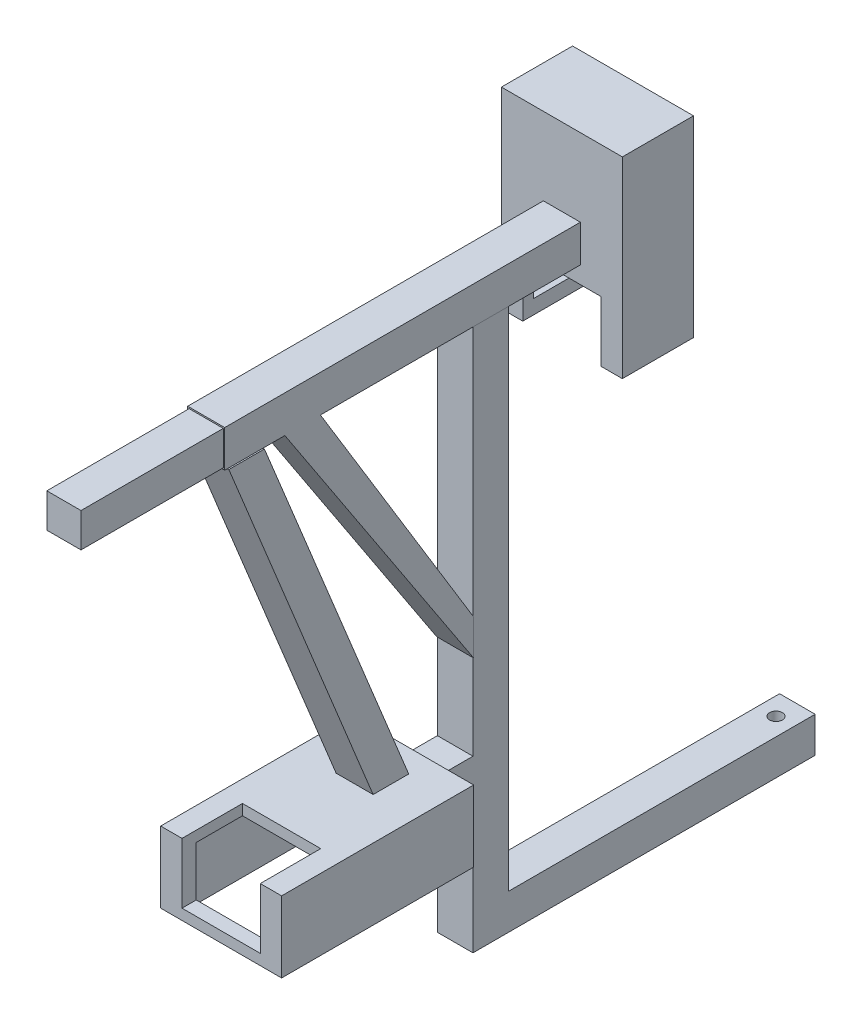
from build123d import *

# Parameters (mm, degrees)
SKETCH1_W            = 4.8
SKETCH1_H            = 4.8
BOSS_EXTRUDE1_DEPTH  = 20
SKETCH2_W            = 5.2
SKETCH2_H            = 5.2
BOSS_EXTRUDE2_DEPTH  = 50
SKETCH3_W            = 17
SKETCH3_H            = 27
BOSS_EXTRUDE3_DEPTH  = 10
SKETCH4_W            = 13
SKETCH4_H            = 23
CUT_EXTRUDE1_DEPTH   = 8.5
SKETCH5_W            = 11
SKETCH5_H            = 8.5
CUT_EXTRUDE2_DEPTH   = 8.5
SKETCH6_W            = 5
SKETCH6_H            = 5
BOSS_EXTRUDE4_DEPTH  = 81.5
SKETCH7_W            = 5
SKETCH7_H            = 5
BOSS_EXTRUDE5_DEPTH  = 43.1
SKETCH9_R            = 0.9
CUT_EXTRUDE4_DEPTH   = 125.748466924
BOSS_EXTRUDE6_DEPTH  = 5.2
SKETCH13_W           = 17
SKETCH13_H           = 27
BOSS_EXTRUDE7_DEPTH  = 1.5
SKETCH14_W           = 17
SKETCH14_H           = 27
SKETCH14_W_2         = 13
SKETCH14_H_2         = 23
BOSS_EXTRUDE8_DEPTH  = 8.5
SKETCH15_W           = 11
SKETCH15_H           = 8.5
CUT_EXTRUDE6_DEPTH   = 8.5
BOSS_EXTRUDE9_REACH  = 100.782
SKETCH16_W           = 5
SKETCH16_H           = 5
BOSS_EXTRUDE10_DEPTH = 5.2


with BuildPart() as part:
    # Sketch1 → Boss-Extrude1 (new body)
    with BuildSketch(Plane.XY):
        with Locations((2.4, -2.4)):
            Rectangle(SKETCH1_W, SKETCH1_H)
    extrude(amount=BOSS_EXTRUDE1_DEPTH)

    # Sketch2 → Boss-Extrude2 (add)
    with BuildSketch(Plane(origin=(0, 0, 0), x_dir=(-1, 0, 0), z_dir=(0, 0, -1))):
        with Locations((-2.4, -2.4)):
            Rectangle(SKETCH2_W, SKETCH2_H)
    extrude(amount=BOSS_EXTRUDE2_DEPTH)

    # Sketch3 → Boss-Extrude3 (add)
    with BuildSketch(Plane(origin=(0, 0, -50), x_dir=(-1, 0, 0), z_dir=(0, 0, -1))):
        with Locations((-2.4, -2.4)):
            Rectangle(SKETCH3_W, SKETCH3_H)
    extrude(amount=BOSS_EXTRUDE3_DEPTH)

    # Sketch4 → Cut-Extrude1 (cut)
    with BuildSketch(Plane(origin=(0, 0, -60), x_dir=(-1, 0, 0), z_dir=(0, 0, -1))):
        with Locations((-2.4, -2.4)):
            Rectangle(SKETCH4_W, SKETCH4_H)
    extrude(amount=-CUT_EXTRUDE1_DEPTH, mode=Mode.SUBTRACT)

    # Sketch5 → Cut-Extrude2 (cut)
    with BuildSketch(Plane.XZ.offset(15.9)):
        with Locations((2.4, -54.25)):
            Rectangle(SKETCH5_W, SKETCH5_H)
    extrude(amount=-CUT_EXTRUDE2_DEPTH, mode=Mode.SUBTRACT)

    # Sketch6 → Boss-Extrude4 (add)
    with BuildSketch(Plane(origin=(0, 0.2, 0), x_dir=(1, 0, 0), z_dir=(0, 1, 0))):
        with Locations((2.4, 37.5)):
            Rectangle(SKETCH6_W, SKETCH6_H)
    extrude(amount=-BOSS_EXTRUDE4_DEPTH)

    # Sketch7 → Boss-Extrude5 (add)
    with BuildSketch(Plane(origin=(0, 0, -40), x_dir=(-1, 0, 0), z_dir=(0, 0, -1))):
        with Locations((-2.4, -78.8)):
            Rectangle(SKETCH7_W, SKETCH7_H)
    extrude(amount=BOSS_EXTRUDE5_DEPTH)

    # Sketch9 → Cut-Extrude4 (cut, through all)
    with BuildSketch(Plane.XZ.offset(81.3)):
        with Locations((2.4, -80.1)):
            Circle(SKETCH9_R)
    extrude(amount=-CUT_EXTRUDE4_DEPTH, mode=Mode.SUBTRACT)

    # Sketch12 → Boss-Extrude6 (add)
    with BuildSketch(Plane(origin=(5, 0, 0), x_dir=(0, 0, -1), z_dir=(1, 0, 0))):
        Polygon((13.455782968, -5), (35, -40.359932103), (35, -45.359932103), (8.455782968, -5), align=None)
    extrude(amount=-BOSS_EXTRUDE6_DEPTH)


with BuildPart() as body_2:
    # Sketch13 → Boss-Extrude7 (new body)
    with BuildSketch(Plane(origin=(0, -54.71, 0), x_dir=(-1, 0, 0), z_dir=(0, -1, 0))):
        with Locations((-2.6, 15.4)):
            Rectangle(SKETCH13_W, SKETCH13_H)
    extrude(amount=BOSS_EXTRUDE7_DEPTH)

    # Sketch14 → Boss-Extrude8 (add)
    with BuildSketch(Plane.XZ.offset(56.21)):
        with Locations((2.6, -15.4)):
            Rectangle(SKETCH14_W, SKETCH14_H)
        with Locations((2.6, -15.4)):
            Rectangle(SKETCH14_W_2, SKETCH14_H_2, mode=Mode.SUBTRACT)
    extrude(amount=BOSS_EXTRUDE8_DEPTH)

    # Sketch15 → Cut-Extrude6 (cut)
    with BuildSketch(Plane.XY.offset(-1.9)):
        with Locations((2.6, -58.96)):
            Rectangle(SKETCH15_W, SKETCH15_H)
    extrude(amount=-CUT_EXTRUDE6_DEPTH, mode=Mode.SUBTRACT)

    # Sketch16 → Boss-Extrude9 (add, up to next)
    with BuildSketch(Plane.XY.offset(-35), mode=Mode.PRIVATE) as boss_extrude9_sk1:
        with Locations((2.4, -59.859932103)):
            Rectangle(SKETCH16_W, SKETCH16_H)
    boss_extrude9_tool1 = extrude(boss_extrude9_sk1.sketch, amount=BOSS_EXTRUDE9_REACH, mode=Mode.PRIVATE) - body_2.part

    add(part.part)  # Boss-Extrude9 merges part
    add(boss_extrude9_tool1.solids().sort_by_distance((2.4, -59.859932, -35))[0])

    # Sketch18 → Boss-Extrude10 (add)
    with BuildSketch(Plane(origin=(0, 0, 0), x_dir=(0, 0, -1), z_dir=(1, 0, 0))):
        Polygon((25.666047821, -54.71), (5.38231876, -5), (0.38231876, -5), (20.666047821, -54.71), align=None)
    extrude(amount=BOSS_EXTRUDE10_DEPTH)


solid = body_2.part
